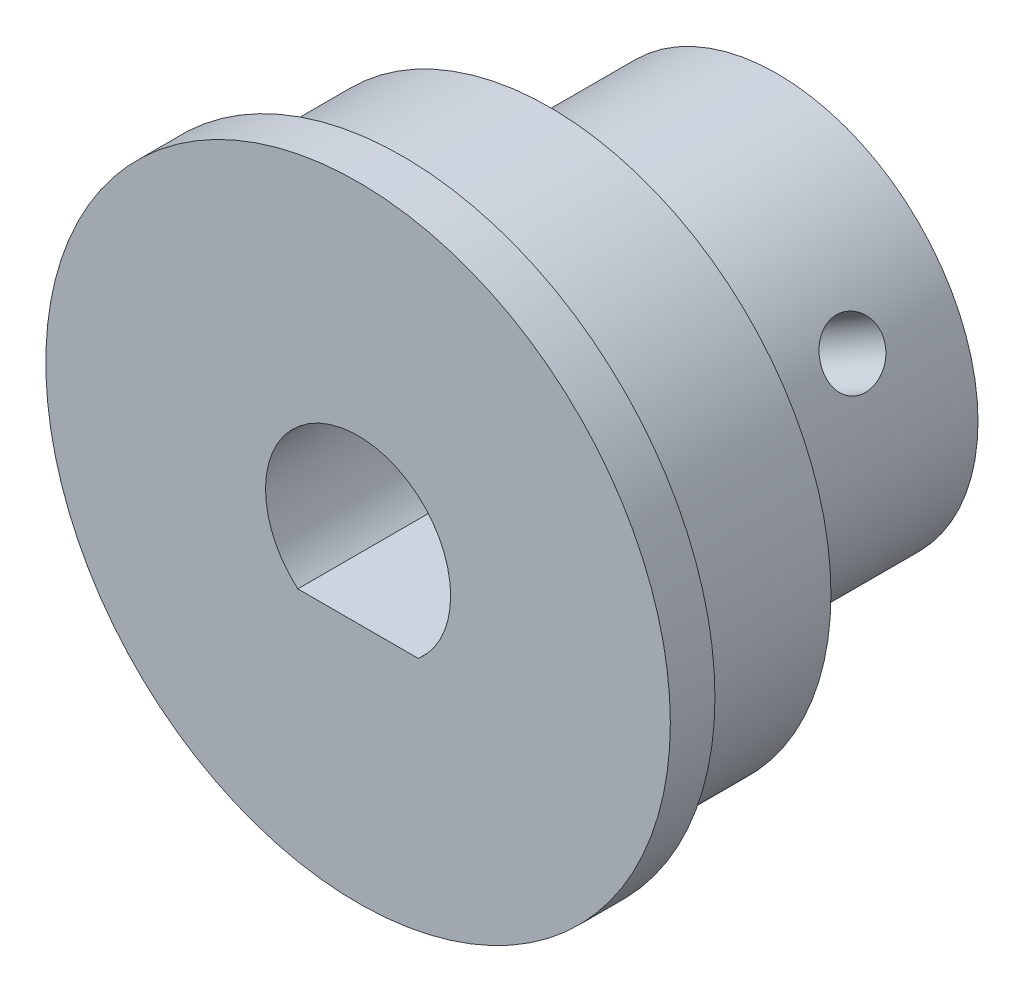
from build123d import *

# Parameters (mm, degrees)
SKETCH_1_R               = 12.6
EXTRUDE_1_DEPTH          = 6.6
SKETCH_2_R               = 14
EXTRUDE_2_DEPTH          = 2
SKETCH_4_R               = 9
EXTRUDE_3_DEPTH          = 10
CUT_EXTRUDE_START        = -4
SKETCH_5_R               = 1.35
CUT_EXTRUDE_2_DEPTH      = 8
CUT_EXTRUDE_1_DEPTH      = 28.165419263
PATTERN_CIRCULAR_1_COUNT = 3


with BuildPart() as part:
    # 草图1 → 凸台-拉伸1 (new body)
    with BuildSketch(Plane.XY):
        Circle(SKETCH_1_R)
    extrude(amount=EXTRUDE_1_DEPTH)

    # 草图2 → 凸台-拉伸2 (add)
    with BuildSketch(Plane.XY.offset(6.6)):
        Circle(SKETCH_2_R)
    extrude(amount=EXTRUDE_2_DEPTH)

    # 草图4 → 凸台-拉伸3 (add)
    with BuildSketch(Plane(origin=(0, 0, 0), x_dir=(-1, 0, 0), z_dir=(0, 0, -1))):
        with Locations((-0.193153064, 0)):
            Circle(SKETCH_4_R)
    extrude(amount=EXTRUDE_3_DEPTH)

    # 草图5 → 切除-拉伸2 (cut)
    with BuildSketch(Plane(origin=(0, 0, 0), x_dir=(1, 0, 0), z_dir=(0, 1, 0)).offset(CUT_EXTRUDE_START)):
        with Locations(Location((0, 5.5, 0), (0, 0, 270))):
            Circle(SKETCH_5_R)
    cut_extrude_2 = extrude(amount=-CUT_EXTRUDE_2_DEPTH, mode=Mode.SUBTRACT)

    # 草图3 → 切除-拉伸1 (cut, through all)
    with BuildSketch(Plane.XY.offset(8.6)):
        with BuildLine():
            Line((-2.701851217, -3.15), (2.701851217, -3.15))
            ThreePointArc((2.701851217, -3.15), (0, 4.15), (-2.701851217, -3.15))
        make_face()
    extrude(amount=-CUT_EXTRUDE_1_DEPTH, mode=Mode.SUBTRACT)

    # 阵列(圆周)1: 切除-拉伸2 ×3 about axis
    pattern_circular_1_axis = Axis((0.193153064, 0, 0), (0, 0, 1))
    for i in range(1, PATTERN_CIRCULAR_1_COUNT):
        add(cut_extrude_2.rotate(pattern_circular_1_axis, i * 360 / PATTERN_CIRCULAR_1_COUNT), mode=Mode.SUBTRACT)


solid = part.part
